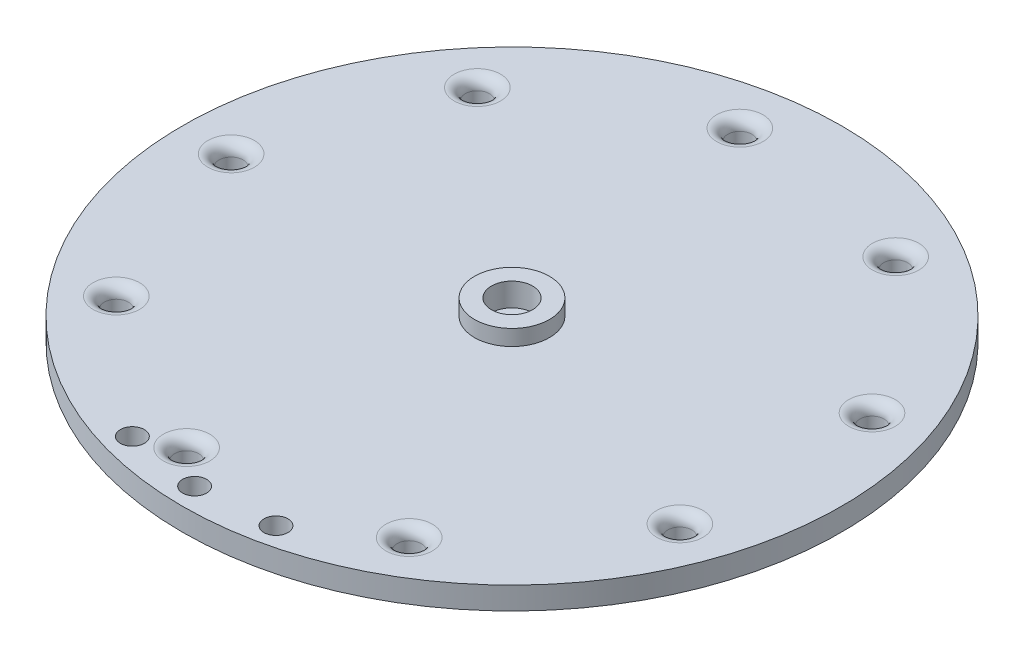
from build123d import *

# Parameters (mm, degrees)
SKETCH_1_R           = 44
SKETCH_1_R_2         = 1.6
SKETCH_1_R_3         = 2
EXTRUDE_1_DEPTH      = 1.5
SKETCH_3_R           = 1.6
CUT_EXTRUDE_4_DEPTH  = 10
EXTRUDE_2_DEPTH      = 10
EXTRUDE_2_DEPTH_BACK = 3
SKETCH_4_R           = 2.4
SKETCH_5_R           = 1.6
CUT_EXTRUDE_5_DEPTH  = 64.568860301
EXTRUDE_START        = 2.1
SKETCH_6_R           = 5
SKETCH_6_R_2         = 1.6
EXTRUDE_3_DEPTH      = 2.1
FILLET_1_R           = 1.5
SKETCH_7_R           = 2.75
CUT_EXTRUDE_6_DEPTH  = 11


with BuildPart() as part:
    # 草图1 → 凸台-拉伸1 (new, symmetric)
    with BuildSketch(Plane(origin=(0, 0, 0), x_dir=(1, 0, 0), z_dir=(0, 1, 0))):
        with Locations(Location((0, 0, 0), (0, 0, 270))):
            Circle(SKETCH_1_R)
        with Locations(Location((-37.5, 0, 0), (0, 0, 270))):
            Circle(SKETCH_1_R_2, mode=Mode.SUBTRACT)
        with Locations(Location((-28.726666617, 24.104535363, 0), (0, 0, 270))):
            Circle(SKETCH_1_R_2, mode=Mode.SUBTRACT)
        with Locations(Location((-6.511806663, 36.930290738, 0), (0, 0, 270))):
            Circle(SKETCH_1_R_2, mode=Mode.SUBTRACT)
        with Locations(Location((18.75, 32.475952642, 0), (0, 0, 270))):
            Circle(SKETCH_1_R_2, mode=Mode.SUBTRACT)
        with Locations(Location((35.238473279, 12.825755375, 0), (0, 0, 270))):
            Circle(SKETCH_1_R_2, mode=Mode.SUBTRACT)
        with Locations(Location((35.238473279, -12.825755375, 0), (0, 0, 270))):
            Circle(SKETCH_1_R_2, mode=Mode.SUBTRACT)
        with Locations(Location((18.75, -32.475952642, 0), (0, 0, 270))):
            Circle(SKETCH_1_R_2, mode=Mode.SUBTRACT)
        with Locations(Location((-6.511806663, -36.930290738, 0), (0, 0, 270))):
            Circle(SKETCH_1_R_2, mode=Mode.SUBTRACT)
        with Locations(Location((-28.726666617, -24.104535363, 0), (0, 0, 270))):
            Circle(SKETCH_1_R_2, mode=Mode.SUBTRACT)
        with Locations(Location((0, 0, 0), (0, 0, 270))):
            Circle(SKETCH_1_R_3, mode=Mode.SUBTRACT)
    extrude(amount=EXTRUDE_1_DEPTH, both=True)

    # 草图3 → 切除-拉伸4 (cut)
    with BuildSketch(Plane.XZ.offset(1.5)):
        with Locations(Location((8.488193337, 40, 0), (0, 0, 270))):
            Circle(SKETCH_3_R)
        with Locations(Location((-1.511806663, 40.862744239, 0), (0, 0, 270))):
            Circle(SKETCH_3_R)
        with Locations(Location((-11.420717282, 39.263426275, 0), (0, 0, 270))):
            Circle(SKETCH_3_R)
    extrude(amount=-CUT_EXTRUDE_4_DEPTH, mode=Mode.SUBTRACT)

    # 草图4 → 凸台-拉伸2 (add, two sides: drawn at the far end of the back side and taken through both)
    with BuildSketch(Plane(origin=(0, 1.5, 0), x_dir=(1, 0, 0), z_dir=(0, 1, 0)).offset(-EXTRUDE_2_DEPTH_BACK)):
        with Locations(Location((0, 0, 0), (0, 0, 270))):
            Circle(SKETCH_4_R)
    extrude(amount=EXTRUDE_2_DEPTH + EXTRUDE_2_DEPTH_BACK)

    # 草图5 → 切除-拉伸5 (cut, through all)
    with BuildSketch(Plane(origin=(0, 11.5, 0), x_dir=(1, 0, 0), z_dir=(0, 1, 0))):
        with Locations(Location((0, 0, 0), (0, 0, 270))):
            Circle(SKETCH_5_R)
    extrude(amount=-CUT_EXTRUDE_5_DEPTH, mode=Mode.SUBTRACT)

    # 草图6 → 凸台-拉伸3 (add)
    with BuildSketch(Plane(origin=(0, 1.5, 0), x_dir=(1, 0, 0), z_dir=(0, 1, 0)).offset(EXTRUDE_START)):
        with Locations(Location((0, 0, 0), (0, 0, 270))):
            Circle(SKETCH_6_R)
        with Locations(Location((0, 0, 0), (0, 0, 270))):
            Circle(SKETCH_6_R_2, mode=Mode.SUBTRACT)
    extrude(amount=-EXTRUDE_3_DEPTH)

    # 圆角1
    fillet_1_edges = [part.edges().sort_by_distance(p)[0] for p in [
        (-28.726666617, 1.5, -25.704535363),
        (-6.511806663, 1.5, -38.530290738),
        (18.75, 1.5, -34.075952642),
        (35.238473279, 1.5, -14.425755375),
        (35.238473279, 1.5, 11.225755375),
        (18.75, 1.5, 30.875952642),
        (-6.511806663, 1.5, 35.330290738),
        (-28.726666617, 1.5, 22.504535363),
        (-37.5, 1.5, -1.6),
    ]]
    fillet(fillet_1_edges, radius=FILLET_1_R)

    # 草图7 → 切除-拉伸6 (cut)
    with BuildSketch(Plane(origin=(0, 11.5, 0), x_dir=(1, 0, 0), z_dir=(0, 1, 0))):
        with Locations(Location((0, 0, 0), (0, 0, 270))):
            Circle(SKETCH_7_R)
    extrude(amount=-CUT_EXTRUDE_6_DEPTH, mode=Mode.SUBTRACT)


solid = part.part
